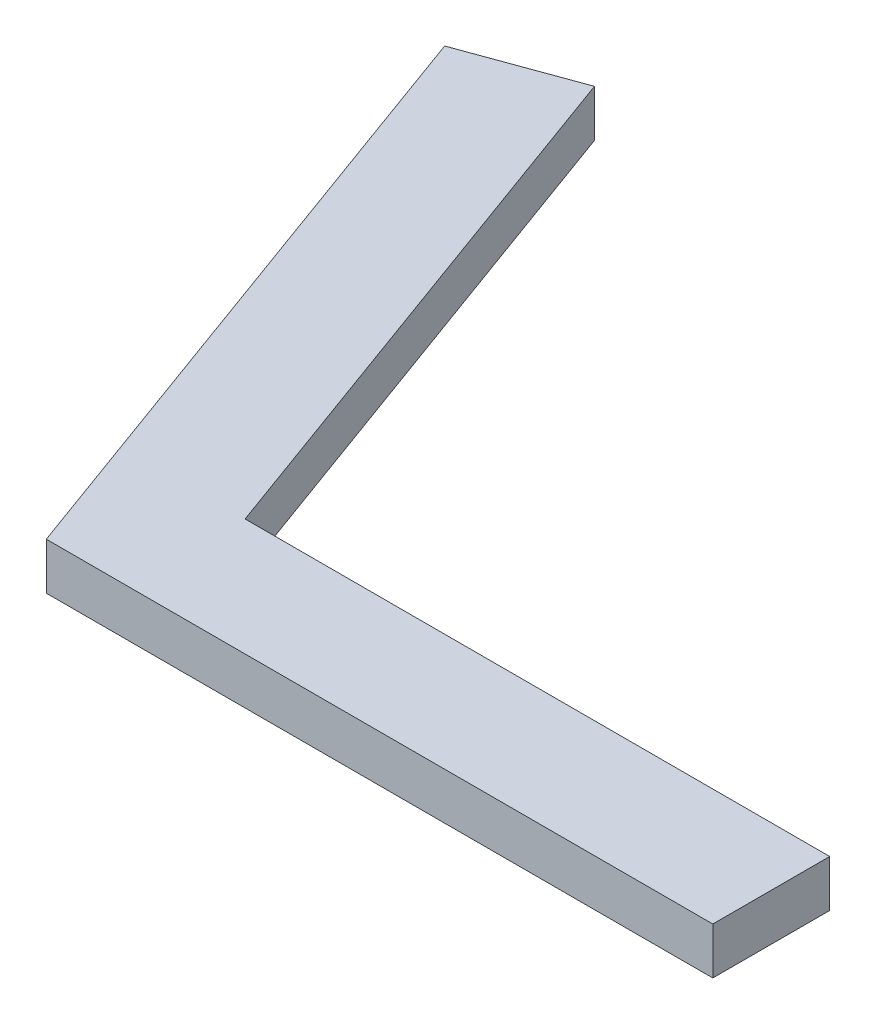
from build123d import *

# Parameters (mm, degrees)
BOSS_EXTRUDE1_DEPTH = 2.54


with BuildPart() as part:
    # Sketch1 → Boss-Extrude1 (new body)
    with BuildSketch(Plane(origin=(0, 0, 0), x_dir=(1, 0, 0), z_dir=(0, 1, 0))):
        Polygon((31.75, 0), (0, 0), (-10.859139551, 29.83524071), (-16.826187693, 27.6634128), (-4.446317868, -6.35), (31.75, -6.35), align=None)
    extrude(amount=BOSS_EXTRUDE1_DEPTH)


solid = part.part
